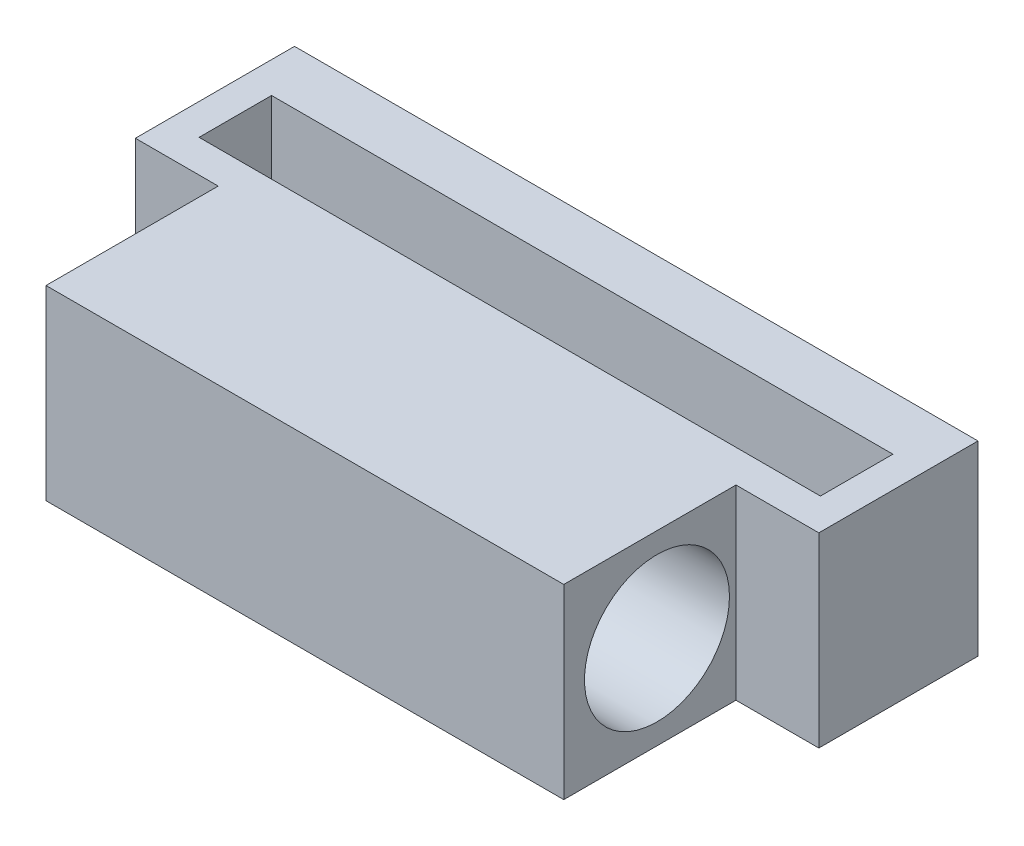
from build123d import *

# Parameters (mm, degrees)
ESQUISSE1_W             = 25
ESQUISSE1_H             = 16
BOSS_EXTRU_1_DEPTH      = 9
ESQUISSE2_R             = 3.5
ENL_V_MAT_EXTRU_1_DEPTH = 32.016124839
BOSS_EXTRU_2_DEPTH      = 4
BOSS_EXTRU_2_DEPTH_BACK = 29
ESQUISSE5_W             = 7.685000099
ESQUISSE5_H             = 9
ESQUISSE3_W             = 30
ESQUISSE3_H             = 3.5
ENL_V_MAT_EXTRU_3_DEPTH = 35.322004603


with BuildPart() as part:
    # Esquisse1 → Boss.-Extru.1 (new body)
    with BuildSketch(Plane(origin=(0, 0, 0), x_dir=(1, 0, 0), z_dir=(0, 1, 0))):
        with Locations((12.5, 8)):
            Rectangle(ESQUISSE1_W, ESQUISSE1_H)
    extrude(amount=BOSS_EXTRU_1_DEPTH)

    # Esquisse2 → Enlèv. mat.-Extru.1 (cut, through all)
    with BuildSketch(Plane(origin=(25, 0, 0), x_dir=(0, 0, -1), z_dir=(1, 0, 0))):
        with Locations((4.5, 4.5)):
            Circle(ESQUISSE2_R)
    extrude(amount=-ENL_V_MAT_EXTRU_1_DEPTH, mode=Mode.SUBTRACT)

    # Esquisse5 → Boss.-Extru.2 (add, two sides: drawn at the far end of the back side and taken through both)
    with BuildSketch(Plane(origin=(25, 0, 0), x_dir=(0, 0, -1), z_dir=(1, 0, 0)).offset(-BOSS_EXTRU_2_DEPTH_BACK)):
        with Locations((12.157499951, 4.5)):
            Rectangle(ESQUISSE5_W, ESQUISSE5_H)
    extrude(amount=BOSS_EXTRU_2_DEPTH + BOSS_EXTRU_2_DEPTH_BACK)

    # Esquisse3 → Enlèv. mat.-Extru.3 (cut, through all)
    with BuildSketch(Plane(origin=(0, 9, 0), x_dir=(1, 0, 0), z_dir=(0, 1, 0))):
        with Locations((12.5, 11.640847207)):
            Rectangle(ESQUISSE3_W, ESQUISSE3_H)
    extrude(amount=-ENL_V_MAT_EXTRU_3_DEPTH, mode=Mode.SUBTRACT)


solid = part.part
